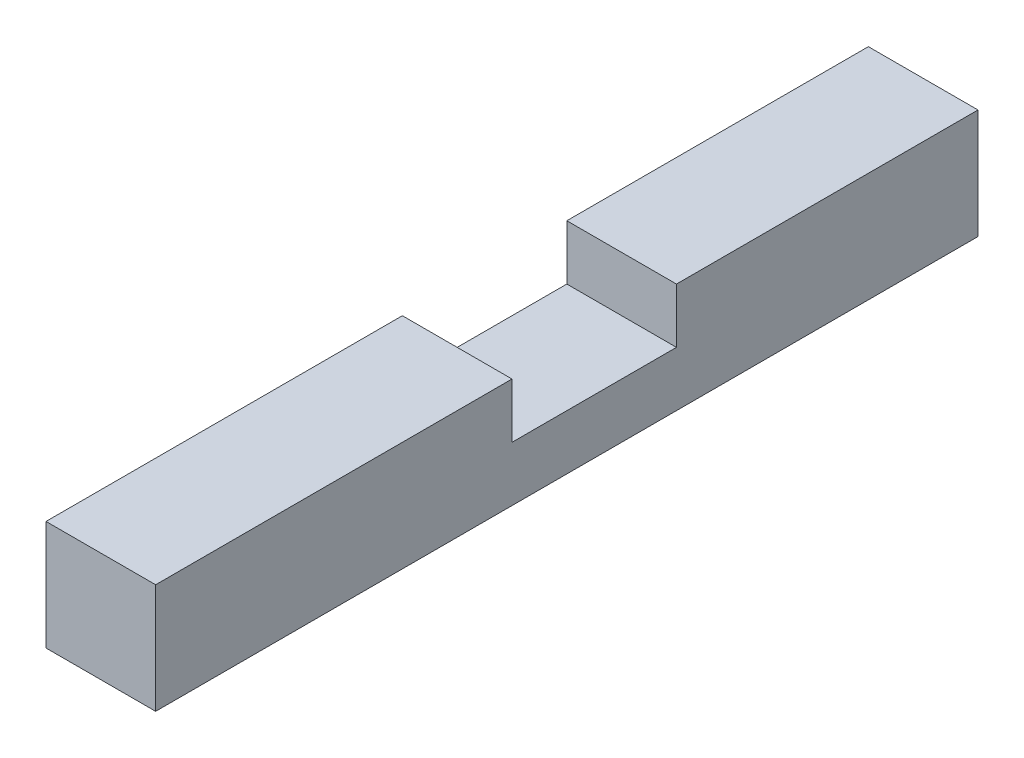
from build123d import *

# Parameters (mm, degrees)
SKETCH_1_W          = 4
SKETCH_1_H          = 4
EXTRUDE_1_DEPTH     = 30
SKETCH_4_W          = 6
SKETCH_4_H          = 2
CUT_EXTRUDE_1_DEPTH = 4


with BuildPart() as part:
    # 草圖1 → 填料-伸長1 (new body)
    with BuildSketch(Plane.XY):
        Rectangle(SKETCH_1_W, SKETCH_1_H)
    extrude(amount=EXTRUDE_1_DEPTH)

    # 草圖4 → 除料-伸長1 (cut)
    with BuildSketch(Plane.ZY.offset(2)):
        with Locations((14, 1)):
            Rectangle(SKETCH_4_W, SKETCH_4_H)
    extrude(amount=-CUT_EXTRUDE_1_DEPTH, mode=Mode.SUBTRACT)


solid = part.part
